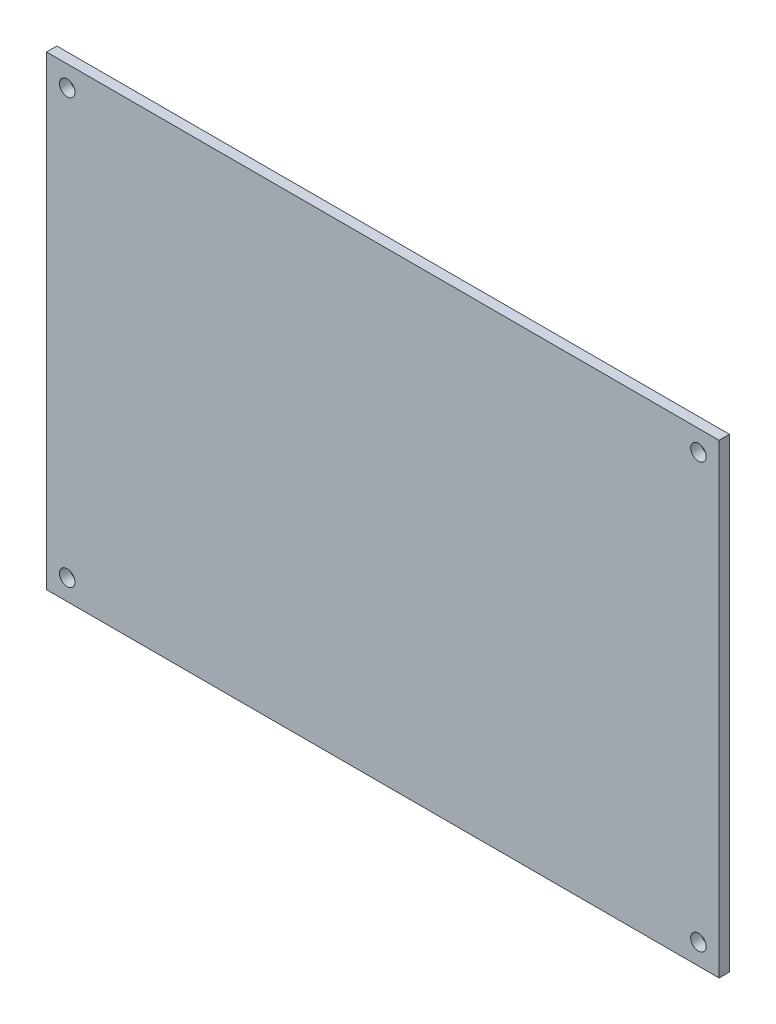
from build123d import *

# Parameters (mm, degrees)
SKETCH1_W      = 165.1
SKETCH1_H      = 114.3
SKETCH1_R      = 1.905
EXTRUDE1_DEPTH = 2.54


with BuildPart() as part:
    # Sketch1 → Extrude1 (new body)
    with BuildSketch(Plane.XY):
        with Locations((82.55, 57.15)):
            Rectangle(SKETCH1_W, SKETCH1_H)
        with Locations((5.08, 109.22)):
            Circle(SKETCH1_R, mode=Mode.SUBTRACT)
        with Locations((160.02, 109.22)):
            Circle(SKETCH1_R, mode=Mode.SUBTRACT)
        with Locations((160.02, 5.08)):
            Circle(SKETCH1_R, mode=Mode.SUBTRACT)
        with Locations((5.08, 5.08)):
            Circle(SKETCH1_R, mode=Mode.SUBTRACT)
    extrude(amount=EXTRUDE1_DEPTH)


solid = part.part
